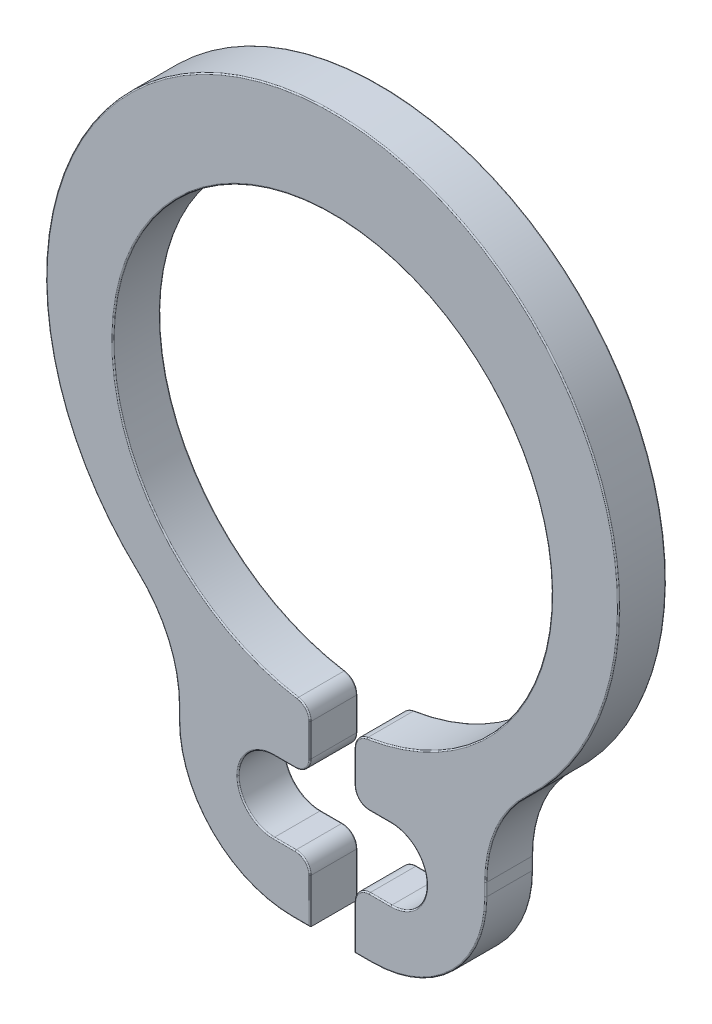
from build123d import *

# Parameters (mm, degrees)
SKETCH3_R                    = 3.7
BOSS_EXTRUDE1_DEPTH          = 0.4
CUT_EXTRUDE_THIN1_DEPTH      = 8.751864292
CUT_EXTRUDE_THIN1_DEPTH_BACK = 8.751864292
SKETCH4_W                    = 0.75
SKETCH4_H                    = 6.9
FILLET2_R                    = 0.25
FILLET1_R                    = 0.02


with BuildPart() as part:
    # Sketch3 → Boss-Extrude1 (new, symmetric)
    with BuildSketch(Plane.XY):
        with BuildLine():
            Line((2.59, -3.918563747), (2.59, -4.13))
            ThreePointArc((2.59, -4.13), (2.02764502, -5.48764502), (0.67, -6.05))
            Line((0.67, -6.05), (-0.67, -6.05))
            ThreePointArc((-0.67, -6.05), (-2.02764502, -5.48764502), (-2.59, -4.13))
            Line((-2.59, -4.13), (-2.59, -3.918563747))
            ThreePointArc((-2.59, -3.918563747), (-2.771946919, -3.045857323), (-3.287471157, -2.318563747))
            ThreePointArc((-3.287471157, -2.318563747), (0, 6.05), (3.287471157, -2.318563747))
            ThreePointArc((3.287471157, -2.318563747), (2.771946919, -3.045857323), (2.59, -3.918563747))
        make_face()
        with Locations((0, 0.85)):
            Circle(SKETCH3_R, mode=Mode.SUBTRACT)
        with BuildLine():
            Line((-0.99, -5.05), (0.99, -5.05))
            ThreePointArc((0.99, -5.05), (1.59, -4.45), (0.99, -3.85))
            Line((0.99, -3.85), (-0.99, -3.85))
            ThreePointArc((-0.99, -3.85), (-1.59, -4.45), (-0.99, -5.05))
        make_face(mode=Mode.SUBTRACT)
    extrude(amount=BOSS_EXTRUDE1_DEPTH, both=True)

    # Sketch4 → Cut-Extrude-Thin1 (cut, two sides: drawn at the far end of the back side and taken through both)
    with BuildSketch(Plane.XY.offset(-CUT_EXTRUDE_THIN1_DEPTH_BACK)):
        with Locations((0, -2.6)):
            Rectangle(SKETCH4_W, SKETCH4_H)
    extrude(amount=CUT_EXTRUDE_THIN1_DEPTH + CUT_EXTRUDE_THIN1_DEPTH_BACK, mode=Mode.SUBTRACT)

    # Fillet2
    fillet2_edges = [part.edges().sort_by_distance(p)[0] for p in [
        (0.375, -2.830947568, 0),
        (-0.375, -2.830947568, 0),
        (-0.375, -5.05, 0),
        (-0.375, -3.85, 0),
        (0.375, -5.05, 0),
        (0.375, -3.85, 0),
    ]]
    fillet(fillet2_edges, radius=FILLET2_R)

    # Fillet1
    fillet1_edges = [part.edges().sort_by_distance(p)[0] for p in [
        (-2.02764502, -5.48764502, 0.4),
        (-2.59, -4.024281874, -0.4),
        (-2.771946919, -3.045857323, -0.4),
        (-0.5225, -6.05, 0.4),
        (2.02764502, -5.48764502, 0.4),
        (2.59, -4.024281874, 0.4),
        (2.771946919, -3.045857323, 0.4),
        (-1.59, -4.45, -0.4),
        (-0.8075, -5.05, -0.4),
        (1.59, -4.45, -0.4),
        (0.8075, -3.85, -0.4),
        (0, 6.05, 0.4),
        (-1.59, -4.45, 0.4),
        (-0.8075, -5.05, 0.4),
        (1.59, -4.45, 0.4),
        (0.8075, -3.85, 0.4),
        (-2.771946919, -3.045857323, 0.4),
        (0.5225, -6.05, -0.4),
        (0.5225, -6.05, 0.4),
        (-2.59, -4.024281874, 0.4),
        (0, 6.05, -0.4),
        (0.8075, -5.05, -0.4),
        (0.8075, -5.05, 0.4),
        (-0.375, -5.675, 0.4),
        (-0.8075, -3.85, 0.4),
        (-0.375, -3.325120189, 0.4),
        (0, 4.55, 0.4),
        (0.375, -3.325120189, 0.4),
        (2.771946919, -3.045857323, -0.4),
        (0.375, -5.675, 0.4),
        (-0.434751162, -2.888051044, 0.4),
        (-0.448223305, -3.776776695, 0.4),
        (0.434751162, -2.888051044, 0.4),
        (0.448223305, -3.776776695, 0.4),
        (-0.448223305, -5.123223305, 0.4),
        (0.448223305, -5.123223305, 0.4),
        (0.375, -5.675, -0.4),
        (2.59, -4.024281874, -0.4),
        (-0.375, -5.675, -0.4),
        (0.375, -3.325120189, -0.4),
        (0, 4.55, -0.4),
        (-0.375, -3.325120189, -0.4),
        (-0.8075, -3.85, -0.4),
        (-0.434751162, -2.888051044, -0.4),
        (-0.448223305, -3.776776695, -0.4),
        (2.02764502, -5.48764502, -0.4),
        (0.434751162, -2.888051044, -0.4),
        (0.448223305, -3.776776695, -0.4),
        (-0.448223305, -5.123223305, -0.4),
        (0.448223305, -5.123223305, -0.4),
        (-0.5225, -6.05, -0.4),
        (-2.02764502, -5.48764502, -0.4),
    ]]
    fillet(fillet1_edges, radius=FILLET1_R)


solid = part.part
